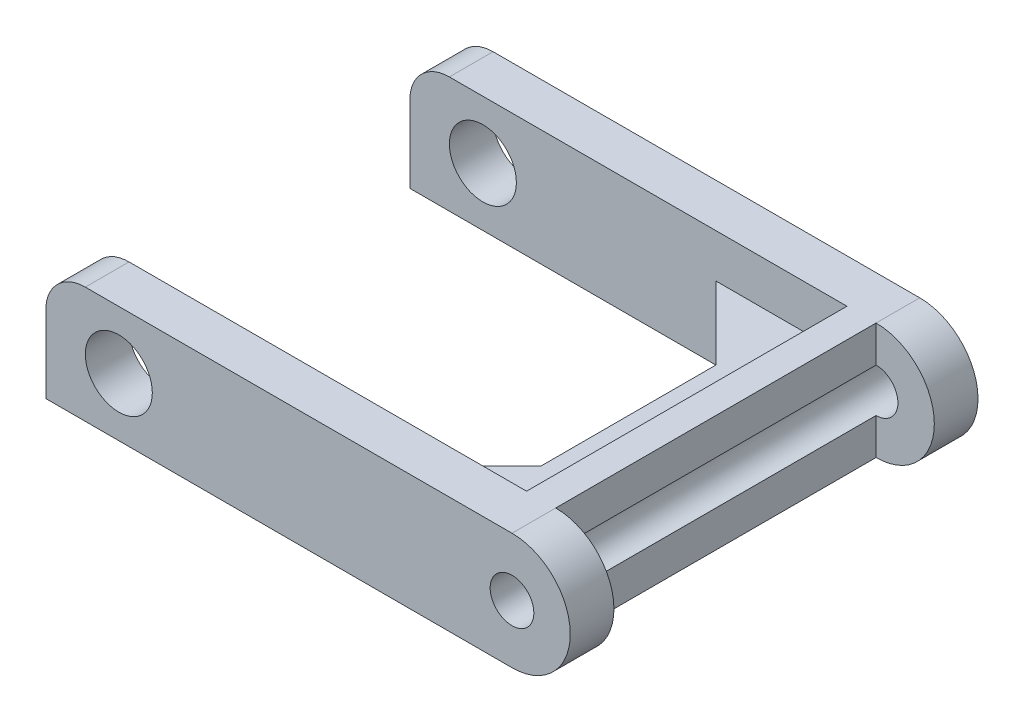
from build123d import *

# Parameters (mm, degrees)
SKETCH5_R           = 1.15
SKETCH5_R_2         = 0.749999784
BASE_EXTRUDE_DEPTH  = 14.000000432
SKETCH9_OUTSIDE_W   = 24.639
SKETCH9_OUTSIDE_H   = 20.632
CUT_EXTRUDE2_DEPTH  = 37.000000432
BOSS_EXTRUDE1_DEPTH = 1.000000047


with BuildPart() as part:
    # Sketch5 → Base-Extrude (new body)
    with BuildSketch(Plane.XY):
        with BuildLine():
            Line((-14.650000216, 1.992481203), (-2.16e-07, 2.000000047))
            ThreePointArc((-2.16e-07, 2.000000047), (2.000000047, 1.08e-07), (0, -2.000000047))
            Line((0, -2.000000047), (-15.999999829, -2.000000047))
            Line((-15.999999829, -2.000000047), (-15.999999829, 0.500000071))
            ThreePointArc((-15.999999829, 0.500000071), (-15.656001468, 1.545642629), (-14.650000216, 1.992481203))
        make_face()
        with Locations((-13.500000216, 4.7e-08)):
            Circle(SKETCH5_R, mode=Mode.SUBTRACT)
        Circle(SKETCH5_R_2, mode=Mode.SUBTRACT)
    extrude(amount=-BASE_EXTRUDE_DEPTH)

    # Sketch9 outside → Cut-Extrude2 (cut)
    with BuildSketch(Plane(origin=(0, 17.539650086, 0), x_dir=(-1, 0, 0), z_dir=(0, 1, 0))):
        with Locations((7.0035, -7)):
            Rectangle(SKETCH9_OUTSIDE_W, SKETCH9_OUTSIDE_H)
        Polygon((5.500000203, -12.500000186), (15.999999829, -12.500000186), (15.999999829, -14.000000432), (-1.999999397, -14.000000432), (-1.999999397, -12.500000186), (0, -12.500000186), (0, -1.500000246), (-1.999999397, -1.500000246), (-1.999999397, 0), (15.999999829, 0), (15.999999829, -1.500000246), (5.500000203, -1.500000246), (1.000000164, -1.500000246), (1.000000164, -12.500000186), align=None, mode=Mode.SUBTRACT)
    extrude(amount=-CUT_EXTRUDE2_DEPTH, mode=Mode.SUBTRACT)

    # Sketch10 → Boss-Extrude1 (add)
    with BuildSketch(Plane(origin=(-42.928367292, 0.500000071, -4.00000019), x_dir=(-1, 0, 0), z_dir=(0, 1, 0))):
        Polygon((-37.428367089, 2.499999944), (-39.928367266, 0), (-39.928367266, -6.000000052), (-37.428367089, -8.499999996), (-41.928367128, -8.499999996), (-41.928367128, 2.499999944), align=None)
    extrude(amount=-BOSS_EXTRUDE1_DEPTH)


solid = part.part
